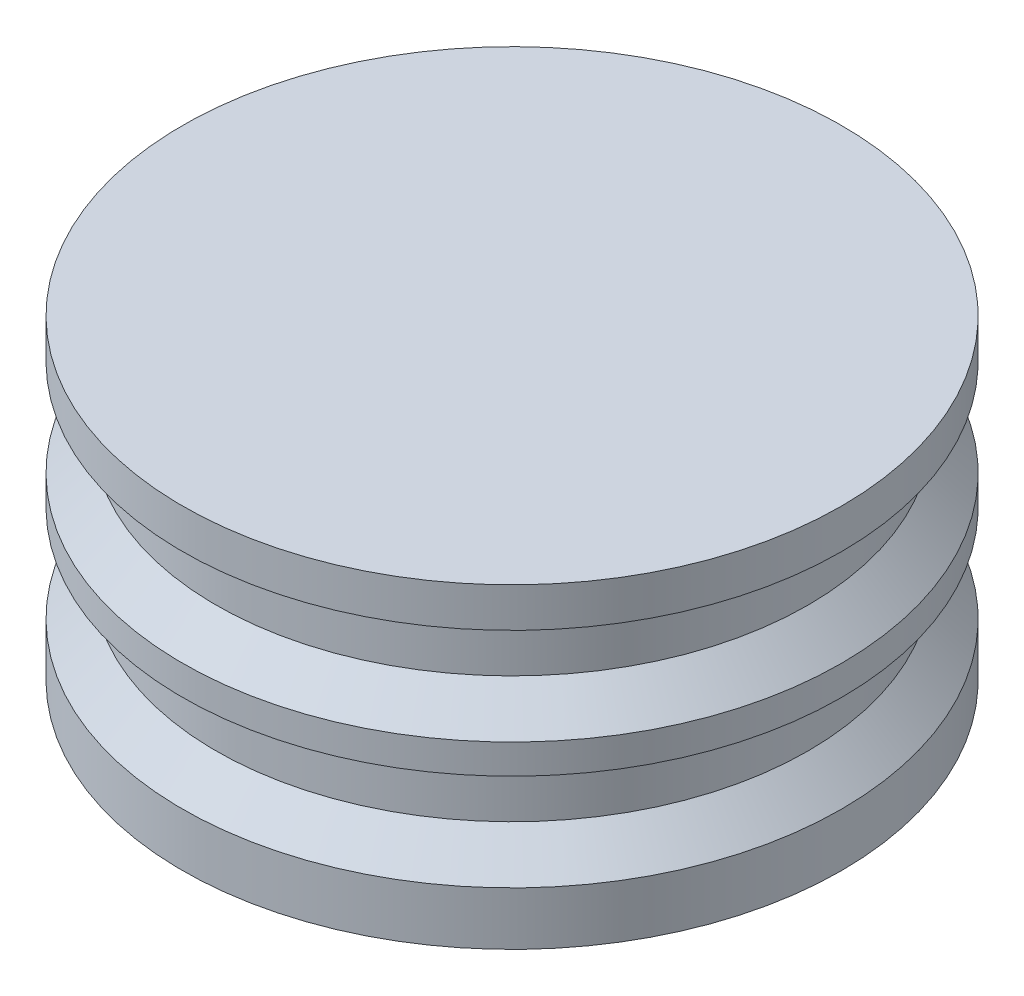
from build123d import *

# Parameters (mm, degrees)
CUT_EXTRUDE1_DEPTH       = 37
SKETCH3_R                = 4
CUT_EXTRUDE2_DEPTH       = 37
SKETCH4_W                = 72
SKETCH4_H                = 1
CUT_EXTRUDE3_DEPTH       = 37
M4_CLEARANCE_HOLE1_D     = 4.5
M4_CLEARANCE_HOLE1_DEPTH = 18
M4_CLEARANCE_HOLE1_TIP   = 1.351936393
CUT_EXTRUDE4_START       = -6
CUT_EXTRUDE4_DEPTH       = 6
SKETCH8_R                = 2.25
BOSS_EXTRUDE1_DEPTH      = 0.5


with BuildPart() as part:
    # Sketch1 → Revolve1 (revolve)
    with BuildSketch(Plane.XY, mode=Mode.PRIVATE) as revolve1_sk:
        Polygon((0, 0), (-41.75, 0), (-41.75, -5), (-37.5, -5), (-37.5, -13), (-41.75, -17.25), (-41.75, -21), (-37.5, -21), (-37.5, -29), (-41.75, -33.25), (-41.75, -40), (0, -40), align=None)
    revolve(revolve1_sk.sketch.rotate(Axis((0, -40, 0), (0, 1, 0)), 180), axis=Axis((0, -40, 0), (0, 1, 0)))

    # Sketch2 → Cut-Extrude1 (cut)
    with BuildSketch(Plane(origin=(0, -40, 0), x_dir=(1, 0, 0), z_dir=(0, 1, 0))):
        Polygon((-21.5, 21.5), (-5, 21.5), (-5, 26.5), (5, 26.5), (5, 21.5), (21.5, 21.5), (21.5, -21.5), (-21.5, -21.5), align=None)
    extrude(amount=CUT_EXTRUDE1_DEPTH, mode=Mode.SUBTRACT)

    # Sketch3 → Cut-Extrude2 (cut)
    with BuildSketch(Plane.XZ.offset(40)):
        with Locations((-27.5, 0)):
            Circle(SKETCH3_R)
        with Locations((27.5, 0)):
            Circle(SKETCH3_R)
    extrude(amount=-CUT_EXTRUDE2_DEPTH, mode=Mode.SUBTRACT)

    # Sketch4 → Cut-Extrude3 (cut)
    with BuildSketch(Plane.XZ.offset(40)):
        Rectangle(SKETCH4_W, SKETCH4_H)
    extrude(amount=-CUT_EXTRUDE3_DEPTH, mode=Mode.SUBTRACT)

    # M4 Clearance Hole1
    with Locations(Plane(origin=(0, -40, 0), x_dir=(-1, 0, 0), z_dir=(0, -1, 0))):
        with Locations((27.5, -15.5), (-27.5, -15.5), (-27.5, 15.5), (27.5, 15.5)):
            Hole(M4_CLEARANCE_HOLE1_D / 2, depth=M4_CLEARANCE_HOLE1_DEPTH)
            with Locations((0, 0, -(M4_CLEARANCE_HOLE1_DEPTH + M4_CLEARANCE_HOLE1_TIP / 2))):  # 118° drill point
                Cone(0, M4_CLEARANCE_HOLE1_D / 2, M4_CLEARANCE_HOLE1_TIP, mode=Mode.SUBTRACT)

    # Sketch7 → Cut-Extrude4 (cut)
    with BuildSketch(Plane.XZ.offset(40).offset(CUT_EXTRUDE4_START)):
        Polygon((-25.450406544, 19.05), (25.450406544, 19.05), (29.549593456, 19.05), (31.599186911, 15.5), (29.549593456, 11.95), (25.450406544, 11.95), (-25.450406544, 11.95), (-29.549593456, 11.95), (-31.599186911, 15.5), (-29.549593456, 19.05), align=None)
        Polygon((25.450406544, -11.95), (-25.450406544, -11.95), (-29.549593456, -11.95), (-31.599186911, -15.5), (-29.549593456, -19.05), (-25.450406544, -19.05), (25.450406544, -19.05), (29.549593456, -19.05), (31.599186911, -15.5), (29.549593456, -11.95), align=None)
    extrude(amount=-CUT_EXTRUDE4_DEPTH, mode=Mode.SUBTRACT)

    # Sketch8 → Boss-Extrude1 (add)
    with BuildSketch(Plane(origin=(0, -34, 0), x_dir=(1, 0, 0), z_dir=(0, 1, 0))):
        with Locations(Location((-27.5, -15.5, 0), (0, 0, 90))):
            Circle(SKETCH8_R)
        with Locations(Location((-27.5, 15.5, 0), (0, 0, 90))):
            Circle(SKETCH8_R)
        with Locations(Location((27.5, 15.5, 0), (0, 0, 90))):
            Circle(SKETCH8_R)
        with Locations(Location((27.5, -15.5, 0), (0, 0, 90))):
            Circle(SKETCH8_R)
    extrude(amount=-BOSS_EXTRUDE1_DEPTH)


solid = part.part
